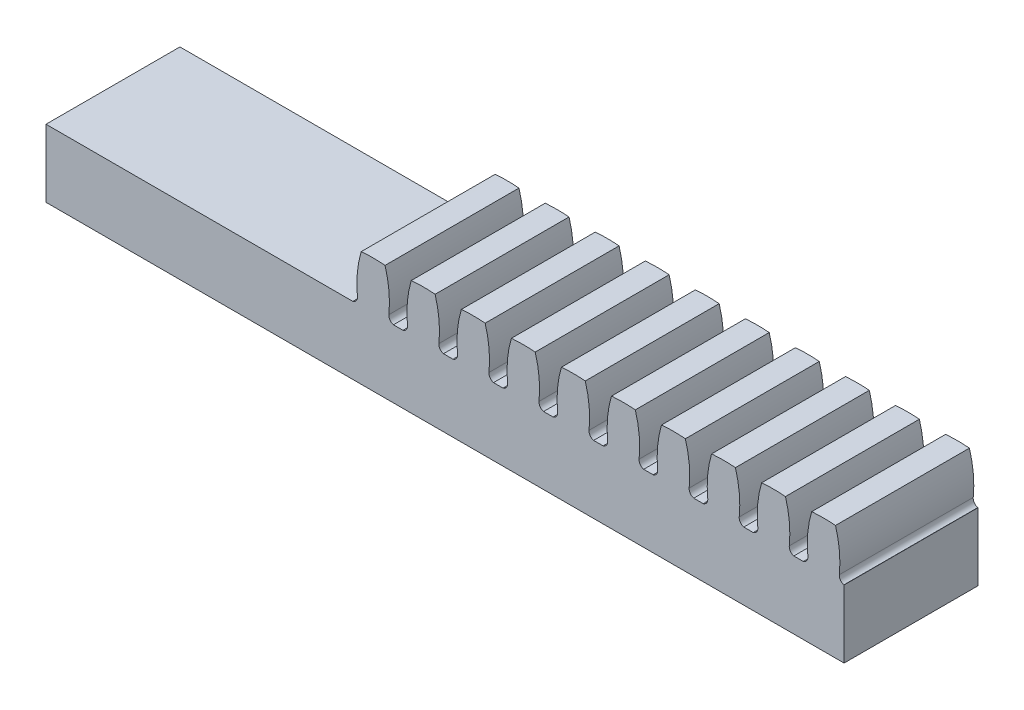
from build123d import *

# Parameters (mm, degrees)
SKETCH1_W           = 59
SKETCH1_H           = 9.9
BOSS_EXTRUDE1_DEPTH = 5
BOSS_EXTRUDE4_DEPTH = 9.9


with BuildPart() as part:
    # Sketch1 → Boss-Extrude1 (new body)
    with BuildSketch(Plane(origin=(0, 0, 0), x_dir=(1, 0, 0), z_dir=(0, 1, 0))):
        with Locations((0, -0.405)):
            Rectangle(SKETCH1_W, SKETCH1_H)
    extrude(amount=BOSS_EXTRUDE1_DEPTH)

    # Sketch7 → Boss-Extrude4 (add, through all)
    with BuildSketch(Plane.XY.offset(5.355)):
        with BuildLine():
            Line((26.46999961, 4.995918044), (29.5, 4.995918044))
            ThreePointArc((29.5, 4.995918044), (29.231205307, 5.171705077), (29.148072876, 5.481931876))
            ThreePointArc((29.148072876, 5.481931876), (29.15553464, 7.003264285), (28.866052019, 8.496819705))
            ThreePointArc((28.866052019, 8.496819705), (27.984999805, 8.533849429), (27.103947591, 8.496819705))
            ThreePointArc((27.103947591, 8.496819705), (26.81446497, 7.003264285), (26.821926734, 5.481931876))
            ThreePointArc((26.821926734, 5.481931876), (26.738794303, 5.171705077), (26.46999961, 4.995918044))
        make_face()
        with BuildLine():
            Line((7.96999961, 4.995918044), (11, 4.995918044))
            ThreePointArc((11, 4.995918044), (10.731205307, 5.171705077), (10.648072876, 5.481931876))
            ThreePointArc((10.648072876, 5.481931876), (10.65553464, 7.003264285), (10.366052019, 8.496819705))
            ThreePointArc((10.366052019, 8.496819705), (9.484999805, 8.533849429), (8.603947591, 8.496819705))
            ThreePointArc((8.603947591, 8.496819705), (8.31446497, 7.003264285), (8.321926734, 5.481931876))
            ThreePointArc((8.321926734, 5.481931876), (8.238794303, 5.171705077), (7.96999961, 4.995918044))
        make_face()
        with BuildLine():
            Line((22.76999961, 4.995918044), (25.8, 4.995918044))
            ThreePointArc((25.8, 4.995918044), (25.531205307, 5.171705077), (25.448072876, 5.481931876))
            ThreePointArc((25.448072876, 5.481931876), (25.45553464, 7.003264285), (25.166052019, 8.496819705))
            ThreePointArc((25.166052019, 8.496819705), (24.284999805, 8.533849429), (23.403947591, 8.496819705))
            ThreePointArc((23.403947591, 8.496819705), (23.11446497, 7.003264285), (23.121926734, 5.481931876))
            ThreePointArc((23.121926734, 5.481931876), (23.038794303, 5.171705077), (22.76999961, 4.995918044))
        make_face()
        with BuildLine():
            Line((19.06999961, 4.995918044), (22.1, 4.995918044))
            ThreePointArc((22.1, 4.995918044), (21.831205307, 5.171705077), (21.748072876, 5.481931876))
            ThreePointArc((21.748072876, 5.481931876), (21.75553464, 7.003264285), (21.466052019, 8.496819705))
            ThreePointArc((21.466052019, 8.496819705), (20.584999805, 8.533849429), (19.703947591, 8.496819705))
            ThreePointArc((19.703947591, 8.496819705), (19.41446497, 7.003264285), (19.421926734, 5.481931876))
            ThreePointArc((19.421926734, 5.481931876), (19.338794303, 5.171705077), (19.06999961, 4.995918044))
        make_face()
        with BuildLine():
            Line((15.36999961, 4.995918044), (18.4, 4.995918044))
            ThreePointArc((18.4, 4.995918044), (18.131205307, 5.171705077), (18.048072876, 5.481931876))
            ThreePointArc((18.048072876, 5.481931876), (18.05553464, 7.003264285), (17.766052019, 8.496819705))
            ThreePointArc((17.766052019, 8.496819705), (16.884999805, 8.533849429), (16.003947591, 8.496819705))
            ThreePointArc((16.003947591, 8.496819705), (15.71446497, 7.003264285), (15.721926734, 5.481931876))
            ThreePointArc((15.721926734, 5.481931876), (15.638794303, 5.171705077), (15.36999961, 4.995918044))
        make_face()
        with BuildLine():
            Line((11.66999961, 4.995918044), (14.7, 4.995918044))
            ThreePointArc((14.7, 4.995918044), (14.431205307, 5.171705077), (14.348072876, 5.481931876))
            ThreePointArc((14.348072876, 5.481931876), (14.35553464, 7.003264285), (14.066052019, 8.496819705))
            ThreePointArc((14.066052019, 8.496819705), (13.184999805, 8.533849429), (12.303947591, 8.496819705))
            ThreePointArc((12.303947591, 8.496819705), (12.01446497, 7.003264285), (12.021926734, 5.481931876))
            ThreePointArc((12.021926734, 5.481931876), (11.938794303, 5.171705077), (11.66999961, 4.995918044))
        make_face()
        with BuildLine():
            Line((4.26999961, 4.995918044), (7.3, 4.995918044))
            ThreePointArc((7.3, 4.995918044), (7.031205307, 5.171705077), (6.948072876, 5.481931876))
            ThreePointArc((6.948072876, 5.481931876), (6.95553464, 7.003264285), (6.666052019, 8.496819705))
            ThreePointArc((6.666052019, 8.496819705), (5.784999805, 8.533849429), (4.903947591, 8.496819705))
            ThreePointArc((4.903947591, 8.496819705), (4.61446497, 7.003264285), (4.621926734, 5.481931876))
            ThreePointArc((4.621926734, 5.481931876), (4.538794303, 5.171705077), (4.26999961, 4.995918044))
        make_face()
        with BuildLine():
            Line((0.56999961, 4.995918044), (3.6, 4.995918044))
            ThreePointArc((3.6, 4.995918044), (3.331205307, 5.171705077), (3.248072876, 5.481931876))
            ThreePointArc((3.248072876, 5.481931876), (3.25553464, 7.003264285), (2.966052019, 8.496819705))
            ThreePointArc((2.966052019, 8.496819705), (2.084999805, 8.533849429), (1.203947591, 8.496819705))
            ThreePointArc((1.203947591, 8.496819705), (0.91446497, 7.003264285), (0.921926734, 5.481931876))
            ThreePointArc((0.921926734, 5.481931876), (0.838794303, 5.171705077), (0.56999961, 4.995918044))
        make_face()
        with BuildLine():
            Line((-3.13000039, 4.995918044), (-0.1, 4.995918044))
            ThreePointArc((-0.1, 4.995918044), (-0.368794693, 5.171705077), (-0.451927124, 5.481931876))
            ThreePointArc((-0.451927124, 5.481931876), (-0.44446536, 7.003264285), (-0.733947981, 8.496819705))
            ThreePointArc((-0.733947981, 8.496819705), (-1.615000195, 8.533849429), (-2.496052409, 8.496819705))
            ThreePointArc((-2.496052409, 8.496819705), (-2.78553503, 7.003264285), (-2.778073266, 5.481931876))
            ThreePointArc((-2.778073266, 5.481931876), (-2.861205697, 5.171705077), (-3.13000039, 4.995918044))
        make_face()
        with BuildLine():
            Line((-6.83000039, 4.995918044), (-3.8, 4.995918044))
            ThreePointArc((-3.8, 4.995918044), (-4.068794693, 5.171705077), (-4.151927124, 5.481931876))
            ThreePointArc((-4.151927124, 5.481931876), (-4.14446536, 7.003264285), (-4.433947981, 8.496819705))
            ThreePointArc((-4.433947981, 8.496819705), (-5.315000195, 8.533849429), (-6.196052409, 8.496819705))
            ThreePointArc((-6.196052409, 8.496819705), (-6.48553503, 7.003264285), (-6.478073266, 5.481931876))
            ThreePointArc((-6.478073266, 5.481931876), (-6.561205697, 5.171705077), (-6.83000039, 4.995918044))
        make_face()
    extrude(amount=-BOSS_EXTRUDE4_DEPTH)


solid = part.part
